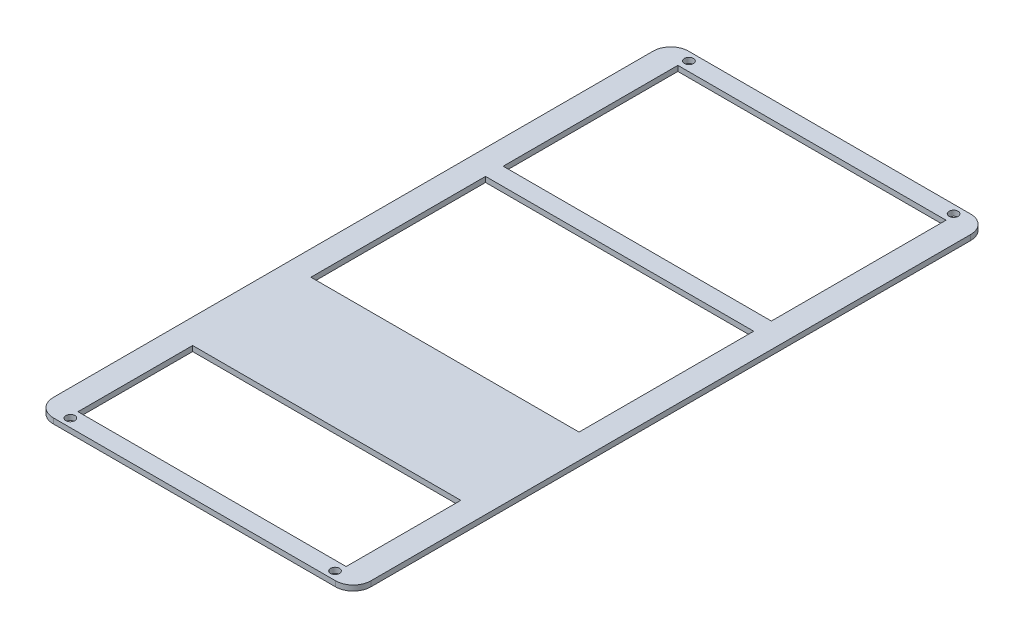
from build123d import *

# Parameters (mm, degrees)
SKETCH1_R           = 2.55
SKETCH1_W           = 152
SKETCH1_H           = 99
SKETCH1_H_2         = 65
BOSS_EXTRUDE1_DEPTH = 3


with BuildPart() as part:
    # Sketch1 → Boss-Extrude1 (new body)
    with BuildSketch(Plane(origin=(0, 0, 0), x_dir=(1, 0, 0), z_dir=(0, 1, 0))):
        with BuildLine():
            Line((-80, -180), (80, -180))
            ThreePointArc((80, -180), (87.071067812, -177.071067812), (90, -170))
            Line((90, -170), (90, 170))
            ThreePointArc((90, 170), (87.071067812, 177.071067812), (80, 180))
            Line((80, 180), (-80, 180))
            ThreePointArc((-80, 180), (-87.071067812, 177.071067812), (-90, 170))
            Line((-90, 170), (-90, -170))
            ThreePointArc((-90, -170), (-87.071067812, -177.071067812), (-80, -180))
        make_face()
        with Locations(Location((-75, 175.287107213, 0), (0, 0, 270))):
            Circle(SKETCH1_R, mode=Mode.SUBTRACT)
        with Locations(Location((75, 175.287107213, 0), (0, 0, 270))):
            Circle(SKETCH1_R, mode=Mode.SUBTRACT)
        with Locations(Location((-75, -175.287107213, 0), (0, 0, 90))):
            Circle(SKETCH1_R, mode=Mode.SUBTRACT)
        with Locations(Location((75, -175.287107213, 0), (0, 0, 90))):
            Circle(SKETCH1_R, mode=Mode.SUBTRACT)
        with Locations((0, 120.5)):
            Rectangle(SKETCH1_W, SKETCH1_H, mode=Mode.SUBTRACT)
        with Locations((0, -137.5)):
            Rectangle(SKETCH1_W, SKETCH1_H_2, mode=Mode.SUBTRACT)
        with Locations((0, 11.5)):
            Rectangle(SKETCH1_W, SKETCH1_H, mode=Mode.SUBTRACT)
    extrude(amount=BOSS_EXTRUDE1_DEPTH)


solid = part.part
